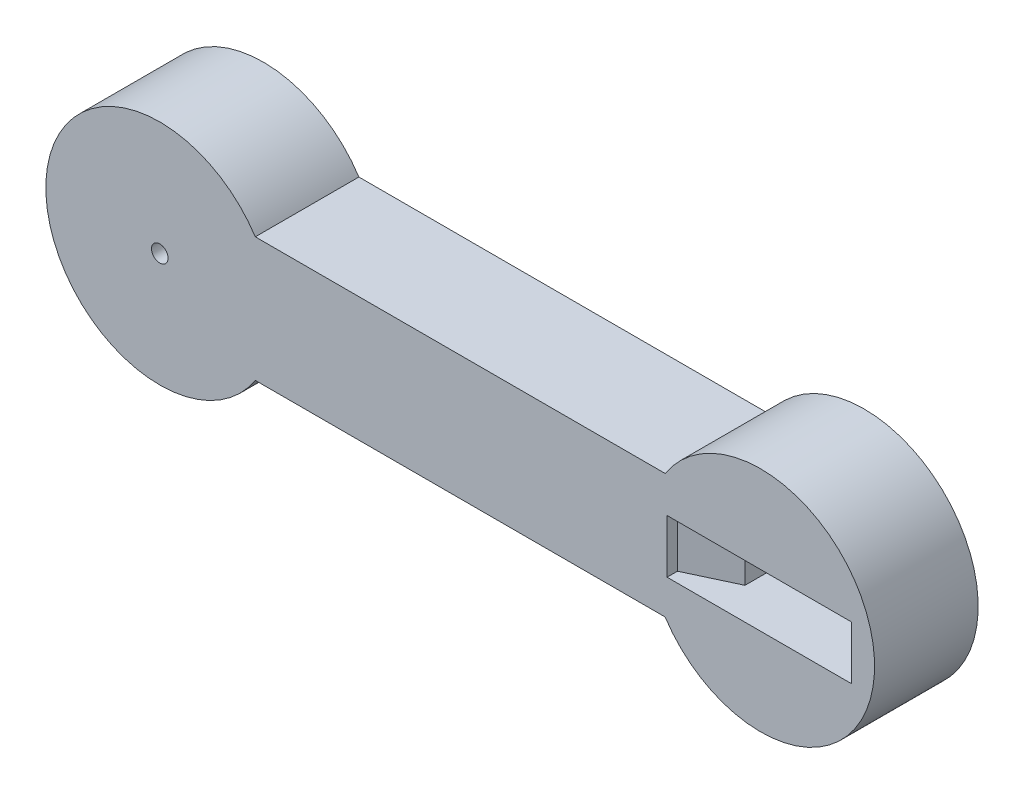
from build123d import *

# Parameters (mm, degrees)
BOSS_EXTRUDE1_DEPTH = 25
SKETCH16_W          = 33.4
SKETCH16_H          = 12.9
CUT_EXTRUDE10_DEPTH = 4.5
SKETCH19_R          = 20
CUT_EXTRUDE14_DEPTH = 5
SKETCH17_W          = 23.6
SKETCH17_H          = 12.9
CUT_EXTRUDE11_DEPTH = 177.45821035
CUT_EXTRUDE13_DEPTH = 6.45
SKETCH20_W          = 33.4
SKETCH20_H          = 12.9
CUT_EXTRUDE15_DEPTH = 176.655202029
SKETCH21_R          = 1.1
CUT_EXTRUDE16_DEPTH = 177.45821035
SKETCH22_R          = 2
CUT_EXTRUDE17_DEPTH = 20


with BuildPart() as part:
    # Sketch1 → Boss-Extrude1 (new body)
    with BuildSketch(Plane.XY):
        with BuildLine():
            ThreePointArc((172.5, 0), (152.823244805, 26.363741023), (121.951138857, 15))
            Line((121.951138857, 15), (145, 15))
            Line((145, 15), (145, -15))
            Line((145, -15), (121.951138857, -15))
            ThreePointArc((121.951138857, -15), (152.823244805, -26.363741023), (172.5, 0))
        make_face()
        with BuildLine():
            Line((145, 15), (121.951138857, 15))
            ThreePointArc((121.951138857, 15), (117.5, 0), (121.951138857, -15))
            Line((121.951138857, -15), (145, -15))
            Line((145, -15), (145, 15))
        make_face()
        with BuildLine():
            Line((121.951138857, 15), (23.048861143, 15))
            ThreePointArc((23.048861143, 15), (26.363741023, 7.823244805), (27.5, 0))
            ThreePointArc((27.5, 0), (26.363741023, -7.823244805), (23.048861143, -15))
            Line((23.048861143, -15), (121.951138857, -15))
            ThreePointArc((121.951138857, -15), (117.5, 0), (121.951138857, 15))
        make_face()
        with BuildLine():
            ThreePointArc((13.228756555, -15), (-20, 0), (13.228756555, 15))
            Line((13.228756555, 15), (23.048861143, 15))
            ThreePointArc((23.048861143, 15), (-27.5, 0), (23.048861143, -15))
            Line((23.048861143, -15), (13.228756555, -15))
        make_face()
        with BuildLine():
            Line((23.048861143, 15), (13.228756555, 15))
            ThreePointArc((13.228756555, 15), (18.228756555, 8.228756555), (20, 0))
            ThreePointArc((20, 0), (18.228756555, -8.228756555), (13.228756555, -15))
            Line((13.228756555, -15), (23.048861143, -15))
            ThreePointArc((23.048861143, -15), (26.363741023, -7.823244805), (27.5, 0))
            ThreePointArc((27.5, 0), (26.363741023, 7.823244805), (23.048861143, 15))
        make_face()
        with BuildLine():
            Line((0, -15), (0, 15))
            Line((0, 15), (13.228756555, 15))
            ThreePointArc((13.228756555, 15), (-20, 0), (13.228756555, -15))
            Line((13.228756555, -15), (0, -15))
        make_face()
        with BuildLine():
            Line((13.228756555, 15), (0, 15))
            Line((0, 15), (0, -15))
            Line((0, -15), (13.228756555, -15))
            ThreePointArc((13.228756555, -15), (18.228756555, -8.228756555), (20, 0))
            ThreePointArc((20, 0), (18.228756555, 8.228756555), (13.228756555, 15))
        make_face()
    extrude(amount=BOSS_EXTRUDE1_DEPTH)

    # Sketch16 → Cut-Extrude10 (cut)
    with BuildSketch(Plane(origin=(0, 0, 0), x_dir=(-1, 0, 0), z_dir=(0, 0, -1))):
        with Locations((-150.21934279, 0)):
            Rectangle(SKETCH16_W, SKETCH16_H)
    extrude(amount=-CUT_EXTRUDE10_DEPTH, mode=Mode.SUBTRACT)

    # Sketch19 → Cut-Extrude14 (cut)
    with BuildSketch(Plane(origin=(0, 0, 0), x_dir=(-1, 0, 0), z_dir=(0, 0, -1))):
        Circle(SKETCH19_R)
    extrude(amount=-CUT_EXTRUDE14_DEPTH, mode=Mode.SUBTRACT)

    # Sketch17 → Cut-Extrude11 (cut, through all)
    with BuildSketch(Plane(origin=(0, 0, 0), x_dir=(-1, 0, 0), z_dir=(0, 0, -1))):
        with Locations((-150.21934279, 0)):
            Rectangle(SKETCH17_W, SKETCH17_H)
    extrude(amount=-CUT_EXTRUDE11_DEPTH, mode=Mode.SUBTRACT)

    # Sketch18 → Cut-Extrude13 (cut, symmetric)
    with BuildSketch(Plane(origin=(0, 0, 0), x_dir=(-1, 0, 0), z_dir=(0, -1, 0))):
        Polygon((-138.41934279, -15), (-138.41934279, -25), (-122.41934279, -25), (-122.41934279, -22.5), align=None)
    extrude(amount=CUT_EXTRUDE13_DEPTH, both=True, mode=Mode.SUBTRACT)

    # Sketch20 → Cut-Extrude15 (cut, through all)
    with BuildSketch(Plane(origin=(0, 0, 6.5), x_dir=(-1, 0, 0), z_dir=(0, 0, -1))):
        with Locations((-150.21934279, 0)):
            Rectangle(SKETCH20_W, SKETCH20_H)
    extrude(amount=-CUT_EXTRUDE15_DEPTH, mode=Mode.SUBTRACT)

    # Sketch21 → Cut-Extrude16 (cut, through all)
    with BuildSketch(Plane(origin=(0, 0, 0), x_dir=(-1, 0, 0), z_dir=(0, 0, -1))):
        with Locations((-163.75, 0)):
            Circle(SKETCH21_R)
        with Locations((-136.75, 0)):
            Circle(SKETCH21_R)
    extrude(amount=-CUT_EXTRUDE16_DEPTH, mode=Mode.SUBTRACT)

    # Sketch22 → Cut-Extrude17 (cut)
    with BuildSketch(Plane.XY.offset(25)):
        Circle(SKETCH22_R)
    extrude(amount=-CUT_EXTRUDE17_DEPTH, mode=Mode.SUBTRACT)


solid = part.part
